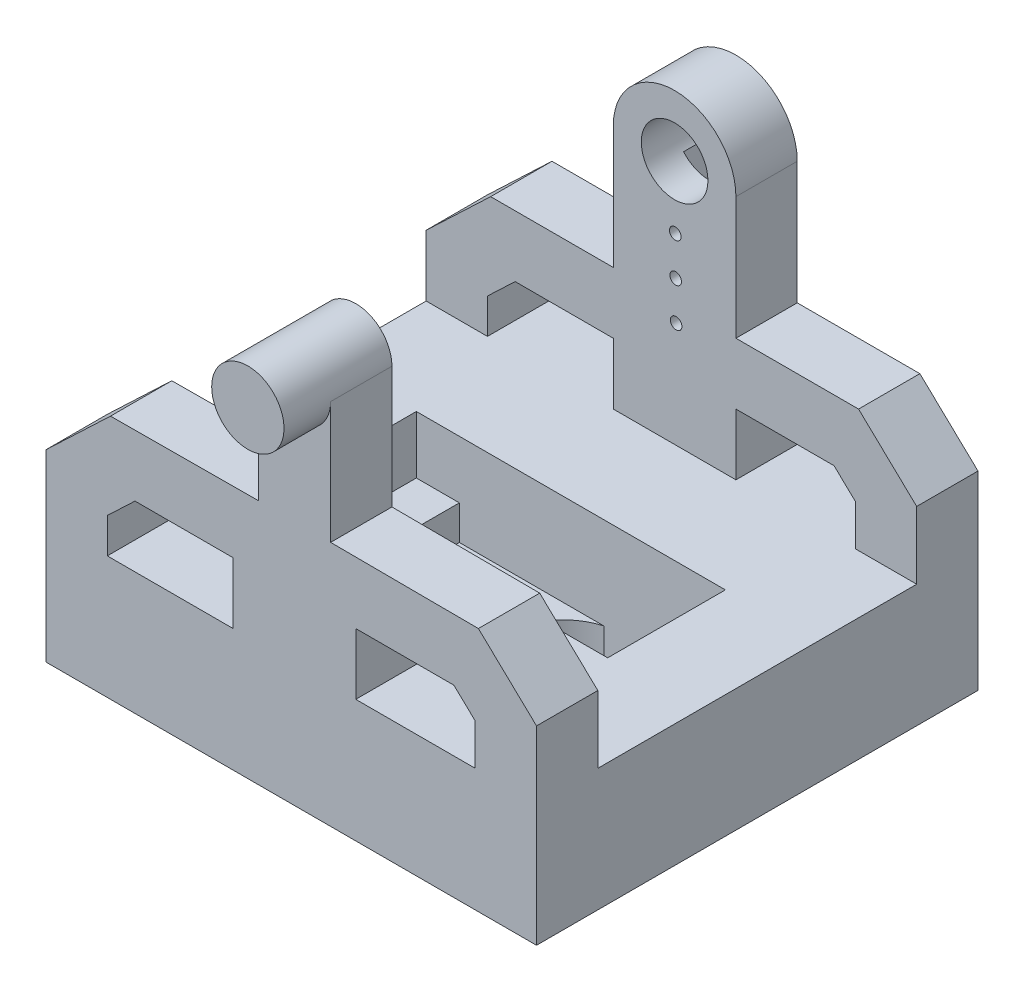
from build123d import *

# Parameters (mm, degrees)
SKETCH1_W           = 50.8
SKETCH1_H           = 45.72
SKETCH1_W_2         = 32.004
SKETCH1_H_2         = 12.192
BOSS_EXTRUDE1_DEPTH = 12.7
BOSS_EXTRUDE2_START = -22.86
SKETCH2_R           = 1.671921998
BOSS_EXTRUDE2_DEPTH = 6.35
BOSS_EXTRUDE3_START = -16.51
SKETCH4_R           = 0.6
BOSS_EXTRUDE3_DEPTH = 3.556
BOSS_EXTRUDE4_DEPTH = 3.175
BOSS_EXTRUDE5_START = 3.175
SKETCH6_W           = 4.454
SKETCH6_H           = 12.192
BOSS_EXTRUDE5_DEPTH = 3.556
BOSS_EXTRUDE6_START = 22.86
BOSS_EXTRUDE6_DEPTH = 6.35
BOSS_EXTRUDE7_START = 22.86
SKETCH8_R           = 3.745494863
BOSS_EXTRUDE7_DEPTH = 4.826


with BuildPart() as part:
    # Sketch1 → Boss-Extrude1 (new body)
    with BuildSketch(Plane(origin=(0, 0, 0), x_dir=(1, 0, 0), z_dir=(0, 1, 0))):
        Rectangle(SKETCH1_W, SKETCH1_H)
        Rectangle(SKETCH1_W_2, SKETCH1_H_2, mode=Mode.SUBTRACT)
    extrude(amount=BOSS_EXTRUDE1_DEPTH)

    # Sketch2 → Boss-Extrude2 (add)
    # profile 1 of 2: a face of its own
    with BuildSketch(Plane.XY.offset(BOSS_EXTRUDE2_START)):
        with BuildLine():
            Line((-6.020374567, 38.1), (-6.020374567, 25.4))
            Line((-6.020374567, 25.4), (-18.720374567, 25.4))
            Line((-18.720374567, 25.4), (-25.4, 19.05))
            Line((-25.4, 19.05), (-25.4, 12.7))
            Line((-25.4, 12.7), (-19.05, 12.7))
            Line((-19.05, 12.7), (-19.05, 16.325160807))
            Line((-19.05, 16.325160807), (-16.18371572, 19.05))
            Line((-16.18371572, 19.05), (-6.020374567, 19.05))
            Line((-6.020374567, 19.05), (-6.020374567, 12.7))
            Line((-6.020374567, 12.7), (6.679625433, 12.7))
            Line((6.679625433, 12.7), (6.679625433, 19.05))
            Line((6.679625433, 19.05), (16.842966586, 19.05))
            Line((16.842966586, 19.05), (19.05, 16.951879032))
            Line((19.05, 16.951879032), (19.05, 12.7))
            Line((19.05, 12.7), (25.4, 12.7))
            Line((25.4, 12.7), (25.4, 19.676718225))
            Line((25.4, 19.676718225), (19.379625433, 25.4))
            Line((19.379625433, 25.4), (6.679625433, 25.4))
            Line((6.679625433, 25.4), (6.679625433, 38.1))
            ThreePointArc((6.679625433, 38.1), (0.329625433, 44.45), (-6.020374567, 38.1))
        make_face()
        with BuildLine():
            Line((-2.296540764, 35.862646406), (-1.515493151, 23.920283336))
            ThreePointArc((-1.515493151, 23.920283336), (0.501683423, 22.050922268), (2.478319103, 23.963099958))
            Line((2.478319103, 23.963099958), (3.003154686, 35.919463063))
            ThreePointArc((3.003154686, 35.919463063), (0.292641005, 41.549801755), (-2.296540764, 35.862646406))
        make_face(mode=Mode.SUBTRACT)
    # profile 2 of 2: a face of its own
    with BuildSketch(Plane.XY.offset(BOSS_EXTRUDE2_START)):
        with Locations((0.329625433, 38.1)):
            Circle(SKETCH2_R)
    extrude(amount=BOSS_EXTRUDE2_DEPTH)


with BuildPart() as boss_extrude2_kept_piece:
    # of the separate pieces the step leaves, the one the design keeps (boss_extrude2_pieces_kept)
    add(part.part.solids().sort_by_distance((-25.4, 0, 22.86))[0])

    # Sketch4 → Boss-Extrude3 (add)
    with BuildSketch(Plane.XY.offset(BOSS_EXTRUDE3_START)):
        with BuildLine():
            ThreePointArc((-1.515493151, 23.920283336), (0.501683423, 22.050922268), (2.478319103, 23.963099958))
            Line((2.478319103, 23.963099958), (3.003154686, 35.919463063))
            ThreePointArc((3.003154686, 35.919463063), (0.366609861, 34.650198245), (-2.296540764, 35.862646406))
            Line((-2.296540764, 35.862646406), (-1.515493151, 23.920283336))
        make_face()
        with Locations((0.484531225, 23.650830329)):
            Circle(SKETCH4_R, mode=Mode.SUBTRACT)
        with Locations((0.441650729, 27.65060048)):
            Circle(SKETCH4_R, mode=Mode.SUBTRACT)
        with Locations((0.398770233, 31.650370631)):
            Circle(SKETCH4_R, mode=Mode.SUBTRACT)
    extrude(amount=-BOSS_EXTRUDE3_DEPTH)

    # Sketch5 → Boss-Extrude4 (add)
    with BuildSketch(Plane(origin=(0, 0, 0), x_dir=(1, 0, 0), z_dir=(0, 1, 0))):
        with BuildLine():
            Line((16.002, 6.354), (5.198, 6.354))
            ThreePointArc((5.198, 6.354), (11.548, 0.004), (5.198, -6.346))
            Line((5.198, -6.346), (16.002, -6.346))
            Line((16.002, -6.346), (16.002, 6.354))
        make_face()
        with BuildLine():
            ThreePointArc((-0.302167411, 3.177430077), (2.022215136, 5.502808098), (5.198, 6.354))
            Line((5.198, 6.354), (-16.002, 6.354))
            Line((-16.002, 6.354), (-16.002, -6.346))
            Line((-16.002, -6.346), (5.198, -6.346))
            ThreePointArc((5.198, -6.346), (2.022215136, -5.494808098), (-0.302167411, -3.169430077))
            ThreePointArc((-0.302167411, -3.169430077), (-3.577, 0.004), (-0.302167411, 3.177430077))
        make_face()
    extrude(amount=BOSS_EXTRUDE4_DEPTH)

    # Sketch6 → Boss-Extrude5 (add)
    with BuildSketch(Plane(origin=(0, 0, 0), x_dir=(1, 0, 0), z_dir=(0, 1, 0)).offset(BOSS_EXTRUDE5_START)):
        with Locations((-13.775, 0)):
            Rectangle(SKETCH6_W, SKETCH6_H)
        with Locations((13.775, 0)):
            Rectangle(SKETCH6_W, SKETCH6_H)
    extrude(amount=BOSS_EXTRUDE5_DEPTH)



with BuildPart() as body_2:
    # Sketch7 → Boss-Extrude6 (new body)
    with BuildSketch(Plane.XY.offset(BOSS_EXTRUDE6_START)):
        with BuildLine():
            Line((-6.020374567, 12.7), (6.679625433, 12.7))
            Line((6.679625433, 12.7), (6.679625433, 19.05))
            Line((6.679625433, 19.05), (16.842966586, 19.05))
            Line((16.842966586, 19.05), (19.05, 16.951879032))
            Line((19.05, 16.951879032), (19.05, 12.7))
            Line((19.05, 12.7), (25.4, 12.7))
            Line((25.4, 12.7), (25.4, 19.676718225))
            Line((25.4, 19.676718225), (19.379625433, 25.4))
            Line((19.379625433, 25.4), (4.075120296, 25.475))
            Line((4.075120296, 25.475), (4.075120296, 38.1))
            ThreePointArc((4.075120296, 38.1), (0.329625433, 41.845494863), (-3.41586943, 38.1))
            Line((-3.41586943, 38.1), (-3.41586943, 25.475))
            Line((-3.41586943, 25.475), (-18.720374567, 25.4))
            Line((-18.720374567, 25.4), (-25.4, 19.05))
            Line((-25.4, 19.05), (-25.4, 12.7))
            Line((-25.4, 12.7), (-19.05, 12.7))
            Line((-19.05, 12.7), (-19.05, 16.325160807))
            Line((-19.05, 16.325160807), (-16.18371572, 19.05))
            Line((-16.18371572, 19.05), (-6.020374567, 19.05))
            Line((-6.020374567, 19.05), (-6.020374567, 12.7))
        make_face()
    extrude(amount=-BOSS_EXTRUDE6_DEPTH)


with BuildPart() as boss_extrude2_kept_piece_1:
    add(boss_extrude2_kept_piece.part)

    add(body_2.part)  # Boss-Extrude7 merges body 2
    # Sketch8 → Boss-Extrude7 (add)
    with BuildSketch(Plane.XY.offset(BOSS_EXTRUDE7_START)):
        with Locations(Location((0.329625433, 38.1, 0), (0, 0, 180))):
            Circle(SKETCH8_R)
    extrude(amount=BOSS_EXTRUDE7_DEPTH)


solid = boss_extrude2_kept_piece_1.part
